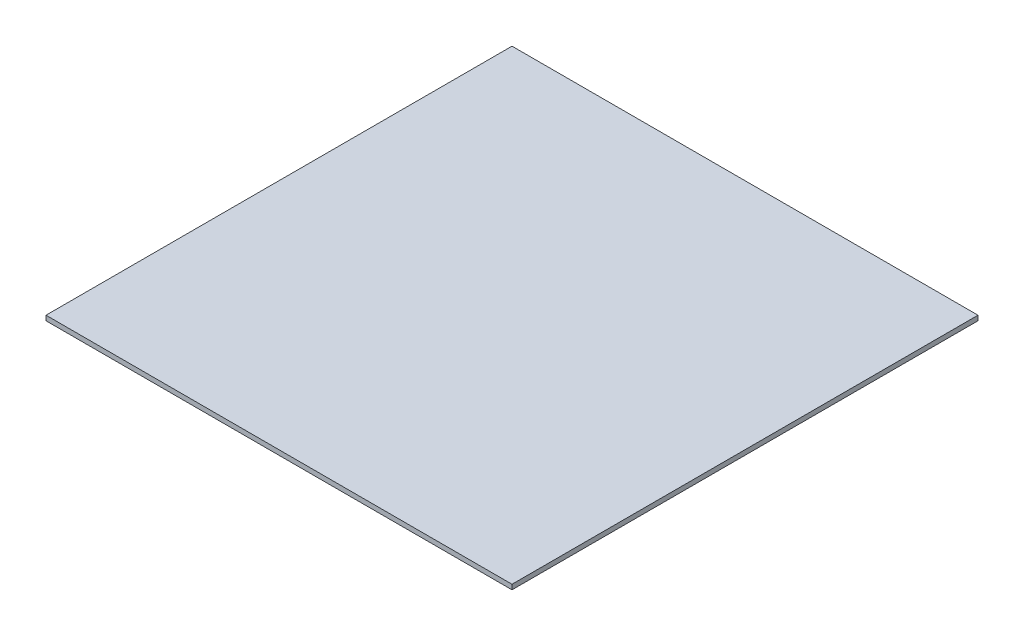
from build123d import *

# Parameters (mm, degrees)
SKETCH2_W           = 304.8
SKETCH2_H           = 3.175
BOSS_EXTRUDE1_DEPTH = 304.8


with BuildPart() as part:
    # Sketch2 → Boss-Extrude1 (new body)
    with BuildSketch(Plane(origin=(0, 0, 0), x_dir=(0, 0, -1), z_dir=(1, 0, 0))):
        with Locations((152.4, -1.5875)):
            Rectangle(SKETCH2_W, SKETCH2_H)
    extrude(amount=BOSS_EXTRUDE1_DEPTH)


solid = part.part
